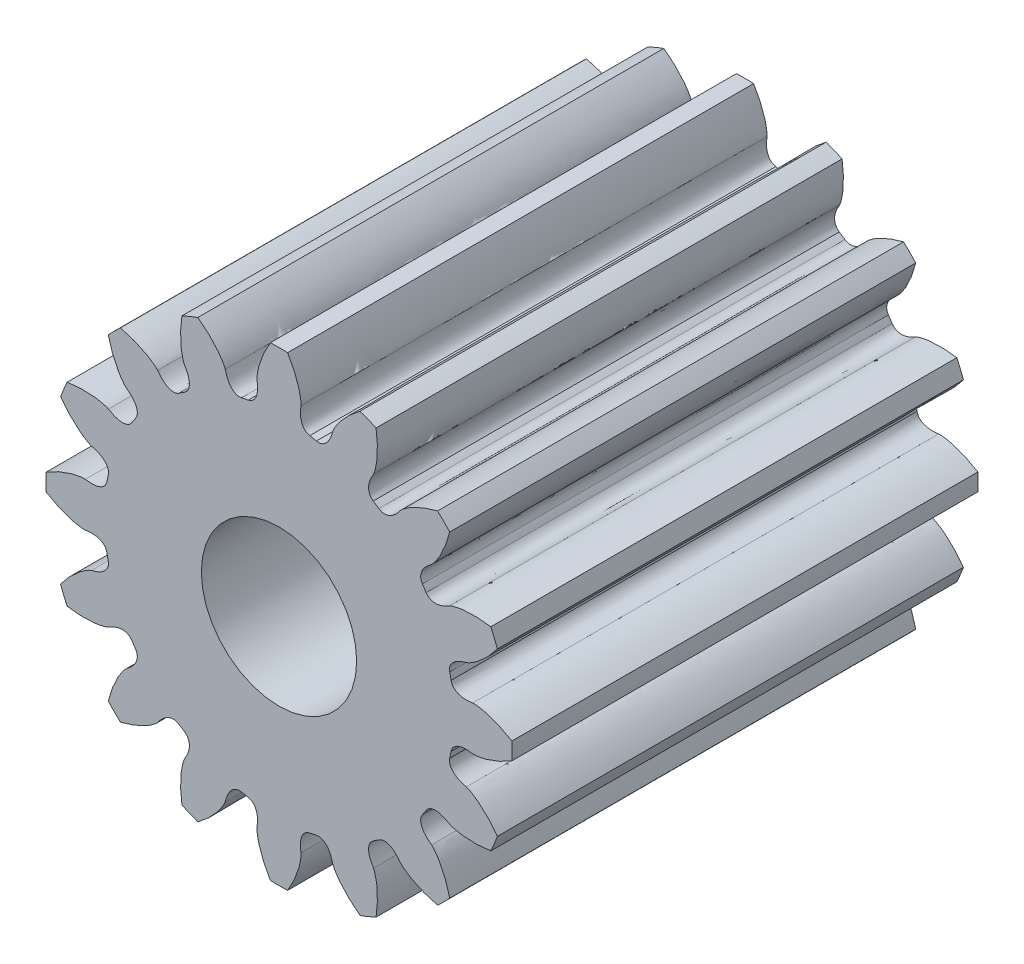
from build123d import *

# Parameters (mm, degrees)
SKETCH_1_R               = 1.6875
EXTRUDE_1_DEPTH          = 4.5
EXTRUDE_2_DEPTH          = 4.5
PATTERN_CIRCULAR_1_COUNT = 16
SKETCH_3_R               = 0.75
CUT_EXTRUDE_1_DEPTH      = 6.511352085


with BuildPart() as part:
    # 스케치1 → 돌출1 (new body)
    with BuildSketch(Plane.XY):
        Circle(SKETCH_1_R)
    extrude(amount=EXTRUDE_1_DEPTH)

    # 스케치2 → 돌출2 (add)
    with BuildSketch(Plane(origin=(0, 0, 0), x_dir=(-1, 0, 0), z_dir=(0, 0, -1))):
        with BuildLine():
            ThreePointArc((-0.083193638, 2.248461434), (0, 2.25), (0.083193638, 2.248461434))
            add(Edge.make_bspline(
                [(0.212548501, 1.870530071), (0.212403066, 1.86966601), (0.21143475, 1.86391305), (0.213658319, 1.893438062), (0.210403535, 1.909974194), (0.204738747, 1.958251183), (0.190774479, 2.012303647), (0.167402123, 2.082504723), (0.132135346, 2.163179192), (0.100342016, 2.218579925), (0.083193638, 2.248461434)],
                knots=[0, 0, 0, 0, 0.00554343, 0.036908403, 0.10517307, 0.210337889, 0.352402962, 0.531368327, 0.747234003, 1, 1, 1, 1], degree=3))
            add(Edge.make_bspline(
                [(0.212548501, 1.870530071), (0.210813759, 1.858934997), (0.207473711, 1.836610002), (0.206353866, 1.803888448), (0.208440191, 1.773346805), (0.214222127, 1.744704994), (0.224417357, 1.717621346), (0.240667809, 1.692582219), (0.264732384, 1.670717835), (0.285980654, 1.664423589), (0.297008425, 1.6611569)],
                knots=[0, 0, 0, 0, 0.140625904, 0.270759164, 0.392102077, 0.507288284, 0.620375018, 0.737138133, 0.863575694, 1, 1, 1, 1], degree=3))
            ThreePointArc((0.297008425, 1.6611569), (0, 1.6875), (-0.297008425, 1.6611569))
            add(Edge.make_bspline(
                [(-0.212548501, 1.870530071), (-0.210813759, 1.858934997), (-0.207473711, 1.836610002), (-0.206353866, 1.803888448), (-0.208440191, 1.773346805), (-0.214222127, 1.744704994), (-0.224417357, 1.717621346), (-0.240667809, 1.692582219), (-0.264732384, 1.670717835), (-0.285980654, 1.664423589), (-0.297008425, 1.6611569)],
                knots=[0, 0, 0, 0, 0.140625904, 0.270759164, 0.392102077, 0.507288284, 0.620375018, 0.737138133, 0.863575694, 1, 1, 1, 1], degree=3))
            add(Edge.make_bspline(
                [(-0.212548501, 1.870530071), (-0.212403066, 1.86966601), (-0.21143475, 1.86391305), (-0.213658319, 1.893438062), (-0.210403535, 1.909974194), (-0.204738747, 1.958251183), (-0.190774479, 2.012303647), (-0.167402123, 2.082504723), (-0.132135346, 2.163179192), (-0.100342016, 2.218579925), (-0.083193638, 2.248461434)],
                knots=[0, 0, 0, 0, 0.00554343, 0.036908403, 0.10517307, 0.210337889, 0.352402962, 0.531368327, 0.747234003, 1, 1, 1, 1], degree=3))
        make_face()
    extrude_2 = extrude(amount=-EXTRUDE_2_DEPTH)

    # 원형 패턴1: 돌출2 ×16 about axis
    pattern_circular_1_axis = Axis((0, 0, -88.99), (0, 0, 1))
    for i in range(1, PATTERN_CIRCULAR_1_COUNT):
        add(extrude_2.rotate(pattern_circular_1_axis, i * 360 / PATTERN_CIRCULAR_1_COUNT))

    # 스케치3 → 컷-돌출1 (cut, through all)
    with BuildSketch(Plane.XY.offset(4.5)):
        Circle(SKETCH_3_R)
    extrude(amount=-CUT_EXTRUDE_1_DEPTH, mode=Mode.SUBTRACT)


solid = part.part
